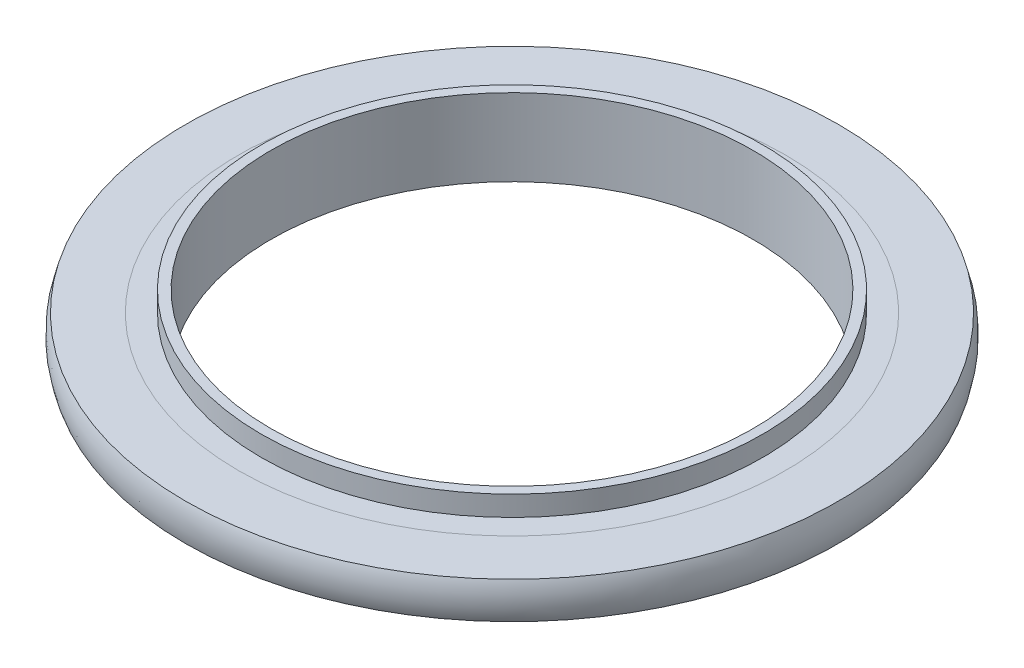
from build123d import *


with BuildPart() as part:
    # Sketch1 → Revolve1 (revolve)
    with BuildSketch(Plane.XY):
        with BuildLine():
            Line((25, 4), (25, -4))
            Line((25, -4), (26, -4))
            Line((26, -4), (26, -1.905))
            Line((26, -1.905), (28.354196223, -1.905))
            ThreePointArc((28.354196223, -1.905), (28, 0), (28.354196223, 1.905))
            Line((28.354196223, 1.905), (26, 1.905))
            Line((26, 1.905), (26, 4))
            Line((26, 4), (25, 4))
        make_face()
    revolve(axis=Axis((0, 4, 0), (0, -1, 0)))


with BuildPart() as body_2:
    # Sketch2 → Revolve2 (revolve)
    with BuildSketch(Plane.XY):
        with BuildLine():
            Line((28.354196223, 1.905), (33.845803777, 1.905))
            ThreePointArc((33.845803777, 1.905), (34.2, 0), (33.845803777, -1.905))
            Line((33.845803777, -1.905), (28.354196223, -1.905))
            ThreePointArc((28.354196223, -1.905), (28, 0), (28.354196223, 1.905))
        make_face()
    revolve(axis=Axis((0, -4, 0), (0, 1, 0)))


solid = Compound([part.part, body_2.part])
